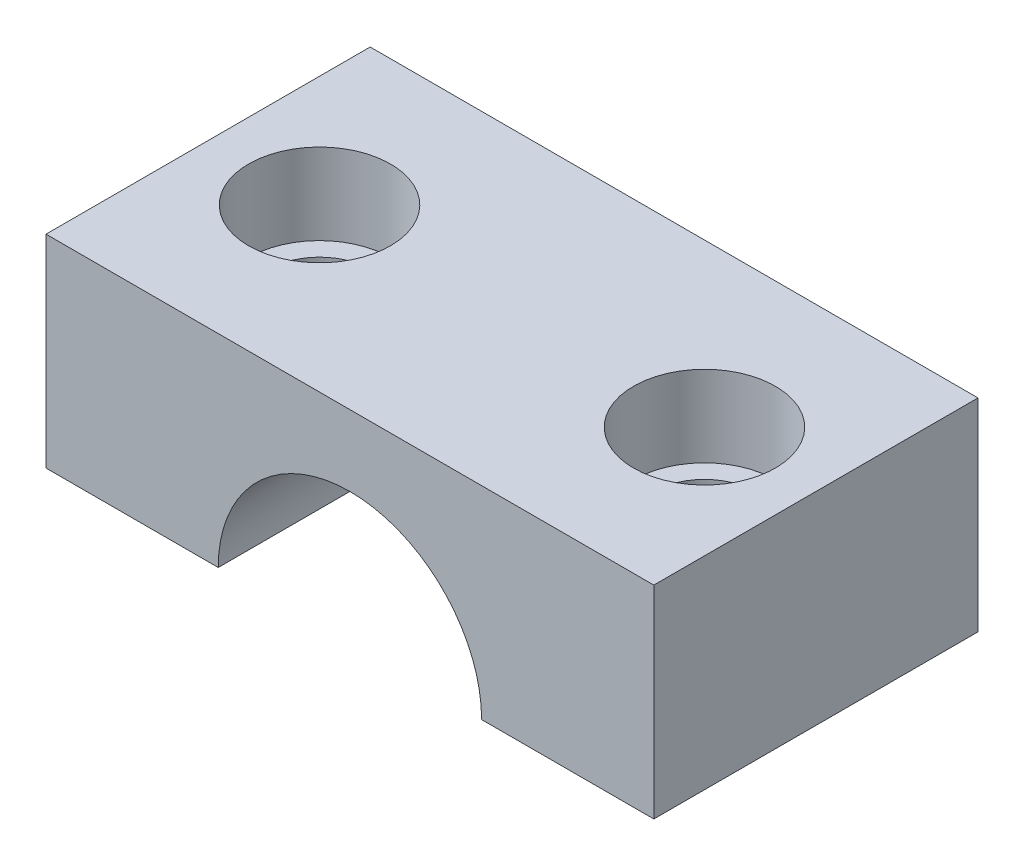
from build123d import *

# Parameters (mm, degrees)
BOSS_EXTRUDE1_DEPTH            = 32
CBORE_FOR_M8_SHCS1_D           = 10
CBORE_FOR_M8_SHCS1_CBORE_D     = 14
CBORE_FOR_M8_SHCS1_CBORE_DEPTH = 8


with BuildPart() as part:
    # Sketch1 → Boss-Extrude1 (new body)
    with BuildSketch(Plane.XY):
        with BuildLine():
            Line((-13, 0), (-30, 0))
            Line((-30, 0), (-30, 20))
            Line((-30, 20), (30, 20))
            Line((30, 20), (30, 0))
            Line((30, 0), (13, 0))
            ThreePointArc((13, 0), (0, 13), (-13, 0))
        make_face()
    extrude(amount=BOSS_EXTRUDE1_DEPTH)

    # CBORE for M8 SHCS1 (through all)
    with Locations(Plane(origin=(0, 20, 0), x_dir=(1, 0, 0), z_dir=(0, 1, 0))):
        with Locations((-19, -16), (19, -16)):
            CounterBoreHole(CBORE_FOR_M8_SHCS1_D / 2, CBORE_FOR_M8_SHCS1_CBORE_D / 2, CBORE_FOR_M8_SHCS1_CBORE_DEPTH)


solid = part.part
